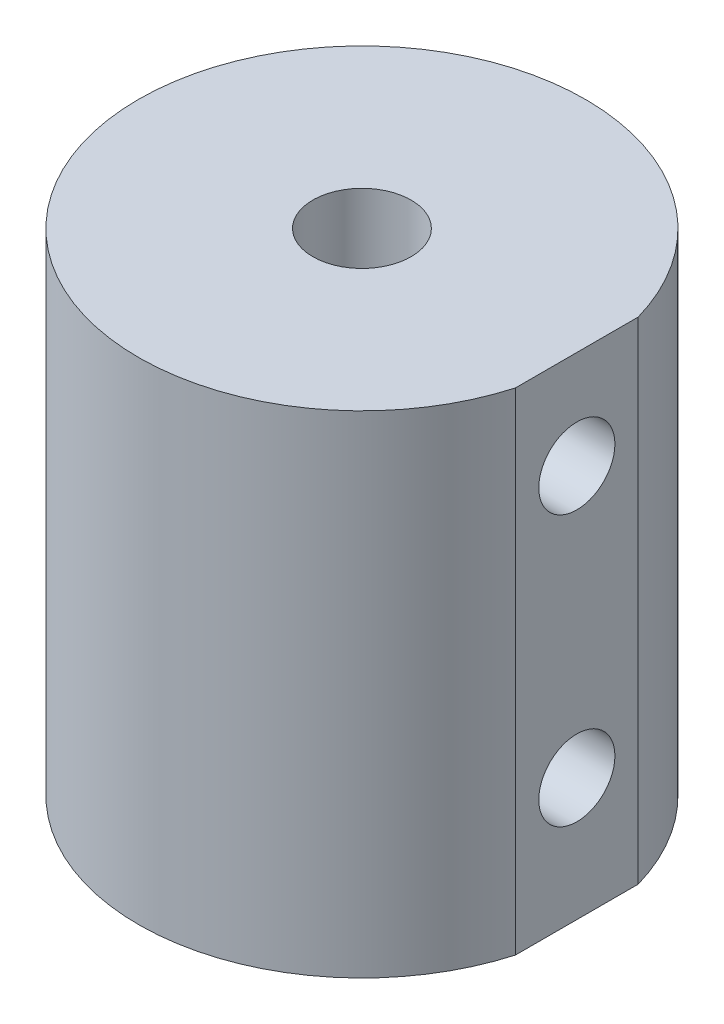
from build123d import *

# Parameters (mm, degrees)
SKETCH1_R           = 18.2
BOSS_EXTRUDE1_DEPTH = 22
SKETCH5_R           = 18.2
SKETCH5_R_2         = 4
BOSS_EXTRUDE4_DEPTH = 18
CUT_EXTRUDE1_DEPTH  = 48.56553374
SKETCH7_R           = 3.1
CUT_EXTRUDE2_DEPTH  = 18


with BuildPart() as part:
    # Sketch1 → Boss-Extrude1 (new body)
    with BuildSketch(Plane(origin=(0, 0, 0), x_dir=(1, 0, 0), z_dir=(0, 1, 0))):
        with Locations(Location((0, 0, 0), (0, 0, 270))):
            Circle(SKETCH1_R)
        with BuildLine():
            Line((2, 7.3), (2, 5.8685603))
            ThreePointArc((2, 5.8685603), (5.041825066, 3.608323711), (6.2, 0))
            ThreePointArc((6.2, 0), (-3.608323711, -5.041825066), (-2, 5.8685603))
            Line((-2, 5.8685603), (-2, 7.3))
            Line((-2, 7.3), (2, 7.3))
        make_face(mode=Mode.SUBTRACT)
    extrude(amount=BOSS_EXTRUDE1_DEPTH)

    # Sketch5 → Boss-Extrude4 (add)
    with BuildSketch(Plane(origin=(0, 22, 0), x_dir=(1, 0, 0), z_dir=(0, 1, 0))):
        with Locations(Location((0, 0, 0), (0, 0, 270))):
            Circle(SKETCH5_R)
        with Locations(Location((0, 0, 0), (0, 0, 270))):
            Circle(SKETCH5_R_2, mode=Mode.SUBTRACT)
    extrude(amount=BOSS_EXTRUDE4_DEPTH)

    # Sketch6 → Cut-Extrude1 (cut, through all)
    with BuildSketch(Plane.XZ):
        Polygon((17.499714283, 100.15185494), (17.499714283, 5), (17.499714283, -5), (17.499714283, -100.15185494), (207.803424163, -100.15185494), (207.803424163, 100.15185494), align=None)
    extrude(amount=-CUT_EXTRUDE1_DEPTH, mode=Mode.SUBTRACT)

    # Sketch7 → Cut-Extrude2 (cut)
    with BuildSketch(Plane(origin=(17.499714283, 0, 0), x_dir=(0, 0, -1), z_dir=(1, 0, 0))):
        with Locations((0, 10)):
            Circle(SKETCH7_R)
        with Locations((0, 32)):
            Circle(SKETCH7_R)
    extrude(amount=-CUT_EXTRUDE2_DEPTH, mode=Mode.SUBTRACT)


solid = part.part
